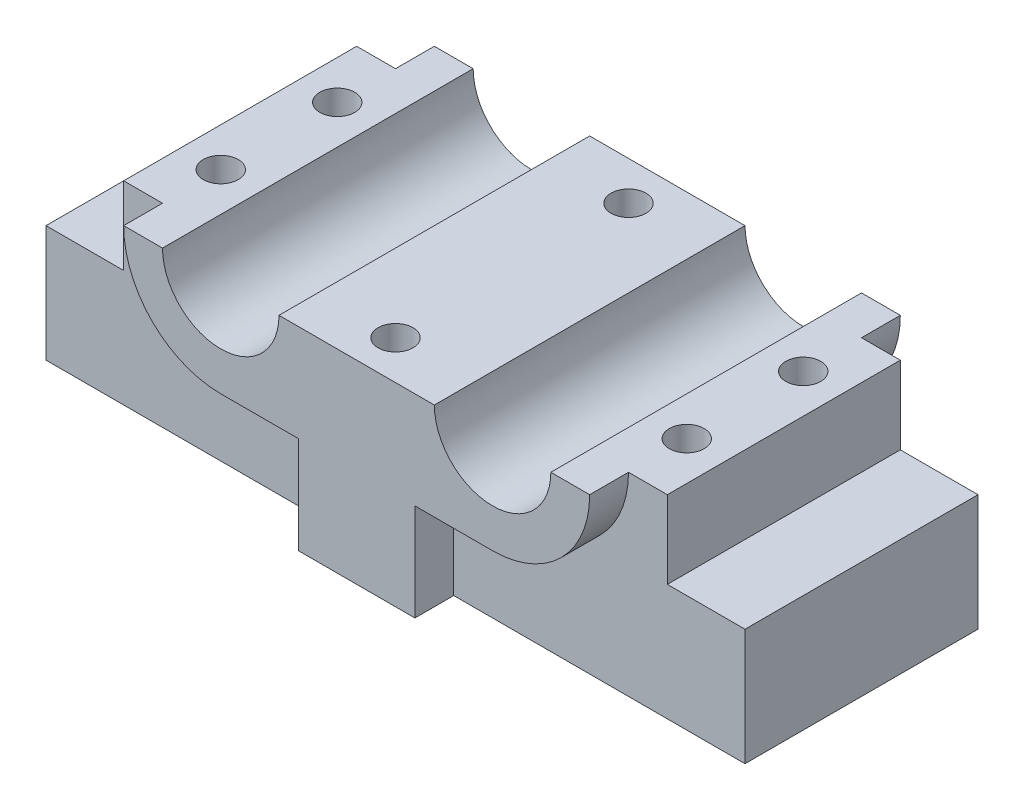
from build123d import *

# Parameters (mm, degrees)
SKETCH1_W               = 90
SKETCH1_H               = 25
BOSS_EXTRUDE1_DEPTH     = 20
CUT_EXTRUDE1_DEPTH      = 62.491869381
CUT_EXTRUDE1_DEPTH_BACK = 62.491869381
SKETCH2_W               = 10
SKETCH2_H               = 10
CUT_EXTRUDE2_DEPTH      = 5
CUT_EXTRUDE3_DEPTH      = 62.491869381
HOLE1_D                 = 4.5
LPATTERN1_COUNT         = 2
LPATTERN1_PITCH         = 15
LPATTERN1_COL_COUNT     = 2
LPATTERN1_COL_PITCH     = 60
MIRROR2_COPY_1_D        = 4.5
MIRROR2_COPY_2_D        = 4.5
MIRROR2_COPY_3_D        = 4.5
HOLE2_D                 = 4.5


with BuildPart() as part:
    # Sketch1 → Boss-Extrude1 (new, symmetric)
    with BuildSketch(Plane.XY):
        Rectangle(SKETCH1_W, SKETCH1_H)
    extrude(amount=BOSS_EXTRUDE1_DEPTH, both=True)

    # Sketch2 → Cut-Extrude1 (cut, two sides: drawn at the far end of the back side and taken through both)
    with BuildSketch(Plane.XY.offset(20).offset(-CUT_EXTRUDE1_DEPTH_BACK)):
        with Locations((-40, 7.5)):
            Rectangle(SKETCH2_W, SKETCH2_H)
        with Locations((40, 7.5)):
            Rectangle(SKETCH2_W, SKETCH2_H)
    extrude(amount=CUT_EXTRUDE1_DEPTH + CUT_EXTRUDE1_DEPTH_BACK, mode=Mode.SUBTRACT)

    # Sketch3 → Cut-Extrude2 (cut)
    with BuildSketch(Plane.XY.offset(20)):
        with BuildLine():
            Line((45, -12.5), (45, 2.5))
            Line((45, 2.5), (35, 2.5))
            Line((35, 2.5), (35, 12.5))
            Line((35, 12.5), (30, 12.5))
            ThreePointArc((30, 12.5), (26.338834765, 3.661165235), (17.5, 0))
            Line((17.5, 0), (7.5, 0))
            Line((7.5, 0), (7.5, -12.5))
            Line((7.5, -12.5), (45, -12.5))
        make_face()
        with BuildLine():
            Line((-7.5, -12.5), (-45, -12.5))
            Line((-45, -12.5), (-45, 2.5))
            Line((-45, 2.5), (-35, 2.5))
            Line((-35, 2.5), (-35, 12.5))
            Line((-35, 12.5), (-30, 12.5))
            ThreePointArc((-30, 12.5), (-26.338834765, 3.661165235), (-17.5, 0))
            Line((-17.5, 0), (-7.5, 0))
            Line((-7.5, 0), (-7.5, -12.5))
        make_face()
    cut_extrude2 = extrude(amount=-CUT_EXTRUDE2_DEPTH, mode=Mode.SUBTRACT)

    # Mirror1: Cut-Extrude2 across plane
    add(cut_extrude2.mirror(Plane.XY), mode=Mode.SUBTRACT)

    # Sketch4 → Cut-Extrude3 (cut, through all)
    with BuildSketch(Plane.XY.offset(20)):
        with BuildLine():
            Line((25, 12.5), (10, 12.5))
            ThreePointArc((10, 12.5), (17.5, 5), (25, 12.5))
        make_face()
        with BuildLine():
            Line((-10, 12.5), (-25, 12.5))
            ThreePointArc((-25, 12.5), (-17.5, 5), (-10, 12.5))
        make_face()
    extrude(amount=-CUT_EXTRUDE3_DEPTH, mode=Mode.SUBTRACT)

    # Hole1 (through all)
    with Locations(Plane(origin=(0, 12.5, 0), x_dir=(1, 0, 0), z_dir=(0, 1, 0))):
        with Locations((30, -7.5)):
            hole1 = Hole(HOLE1_D / 2)

    # LPattern1: Hole1 ×2
    with Locations(*[(0, 0, -i * LPATTERN1_PITCH) for i in range(1, LPATTERN1_COUNT)]):
        add(hole1, mode=Mode.SUBTRACT)

    # LPattern1 col: Hole1 ×2
    with Locations(*[(-i * LPATTERN1_COL_PITCH, 0, 0) for i in range(1, LPATTERN1_COL_COUNT)]):
        add(hole1, mode=Mode.SUBTRACT)

    # Mirror2 copy 1 (through all)
    with Locations(Plane(origin=(0, 12.5, -15), x_dir=(-1, 0, 0), z_dir=(0, 1, 0))):
        with Locations((30, 7.5)):
            Hole(MIRROR2_COPY_1_D / 2)

    # Mirror2 copy 2 (through all)
    with Locations(Plane(origin=(60, 12.5, 0), x_dir=(-1, 0, 0), z_dir=(0, 1, 0))):
        with Locations((30, 7.5)):
            Hole(MIRROR2_COPY_2_D / 2)

    # Mirror2 copy 3 (through all)
    with Locations(Plane(origin=(0, 12.5, 0), x_dir=(-1, 0, 0), z_dir=(0, 1, 0))):
        with Locations((30, 7.5)):
            Hole(MIRROR2_COPY_3_D / 2)

    # Hole2 (through all)
    with Locations(Plane(origin=(0, 12.5, 0), x_dir=(1, 0, 0), z_dir=(0, 1, 0))):
        with Locations((0, -15), (0, 15)):
            Hole(HOLE2_D / 2)


solid = part.part
